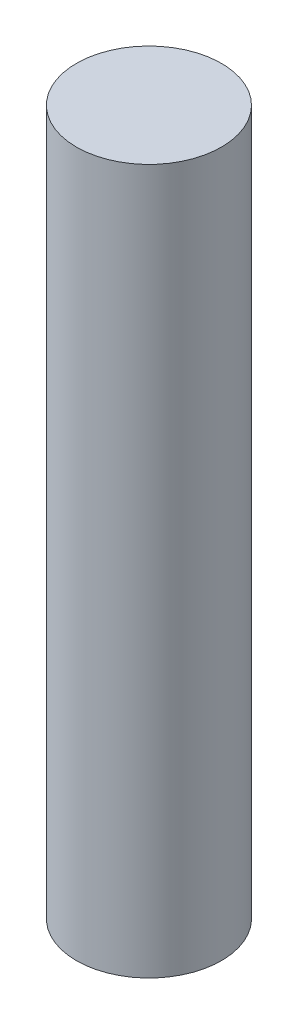
from build123d import *

# Parameters (mm, degrees)
ESBO_O2_W = 7
ESBO_O2_H = 68


with BuildPart() as part:
    # Esboço2 → Revolução2 (revolve)
    with BuildSketch(Plane(origin=(0, 0, 0), x_dir=(0, 0, -1), z_dir=(1, 0, 0)), mode=Mode.PRIVATE) as revolu_o2_sk:
        with Locations((-2.5, 17)):
            Rectangle(ESBO_O2_W, ESBO_O2_H)
    revolve(revolu_o2_sk.sketch.rotate(Axis((0, -17, 6), (0, 1, 0)), 180), axis=Axis((0, -17, 6), (0, 1, 0)))


solid = part.part
